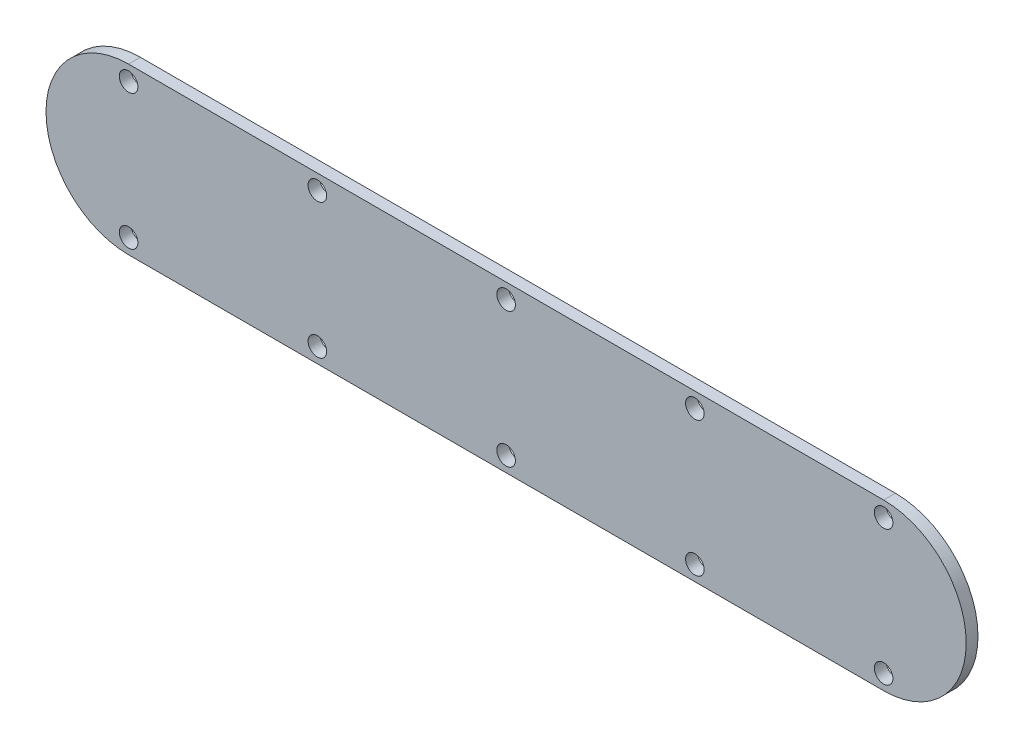
from build123d import *

# Parameters (mm, degrees)
SKETCH1_W                    = 247.65
SKETCH1_H                    = 44.45
BOSS_EXTRUDE1_DEPTH          = 3.175
CUT_EXTRUDE1_DEPTH           = 126.84379951
F_10_0_1935_DIAMETER_HOLE1_D = 4.999999906


with BuildPart() as part:
    # Sketch1 → Boss-Extrude1 (new body)
    with BuildSketch(Plane.XY):
        Rectangle(SKETCH1_W, SKETCH1_H)
    extrude(amount=BOSS_EXTRUDE1_DEPTH)

    # Sketch2 → Cut-Extrude1 (cut, through all)
    with BuildSketch(Plane.XY.offset(3.175)):
        with BuildLine():
            Line((-123.825, 22.225), (-123.825, 5e-09))
            ThreePointArc((-123.825, 5e-09), (-117.31544821, 15.715448214), (-101.6, 22.225))
            Line((-101.6, 22.225), (-123.825, 22.225))
        make_face()
        with BuildLine():
            Line((-123.825, -22.225), (-101.6, -22.225))
            ThreePointArc((-101.6, -22.225), (-117.315448214, -15.71544821), (-123.825, 5e-09))
            Line((-123.825, 5e-09), (-123.825, -22.225))
        make_face()
        with BuildLine():
            ThreePointArc((123.825, -6.4e-08), (117.315448189, -15.715448235), (101.6, -22.225))
            Line((101.6, -22.225), (123.825, -22.225))
            Line((123.825, -22.225), (123.825, -6.4e-08))
        make_face()
        with BuildLine():
            ThreePointArc((101.6, 22.225), (117.315448235, 15.715448189), (123.825, -6.4e-08))
            Line((123.825, -6.4e-08), (123.825, 22.225))
            Line((123.825, 22.225), (101.6, 22.225))
        make_face()
    extrude(amount=-CUT_EXTRUDE1_DEPTH, mode=Mode.SUBTRACT)

    # #10 (0.1935) Diameter Hole1 (through all)
    with Locations(Plane.XY.offset(3.175)):
        with Locations((-101.6, 18.161), (-50.8, 18.161), (0, 18.161), (50.8, 18.161), (101.6, 18.161), (101.6, -18.161), (50.8, -18.161), (0, -18.161), (-50.8, -18.161), (-101.6, -18.161)):
            Hole(F_10_0_1935_DIAMETER_HOLE1_D / 2)


solid = part.part
